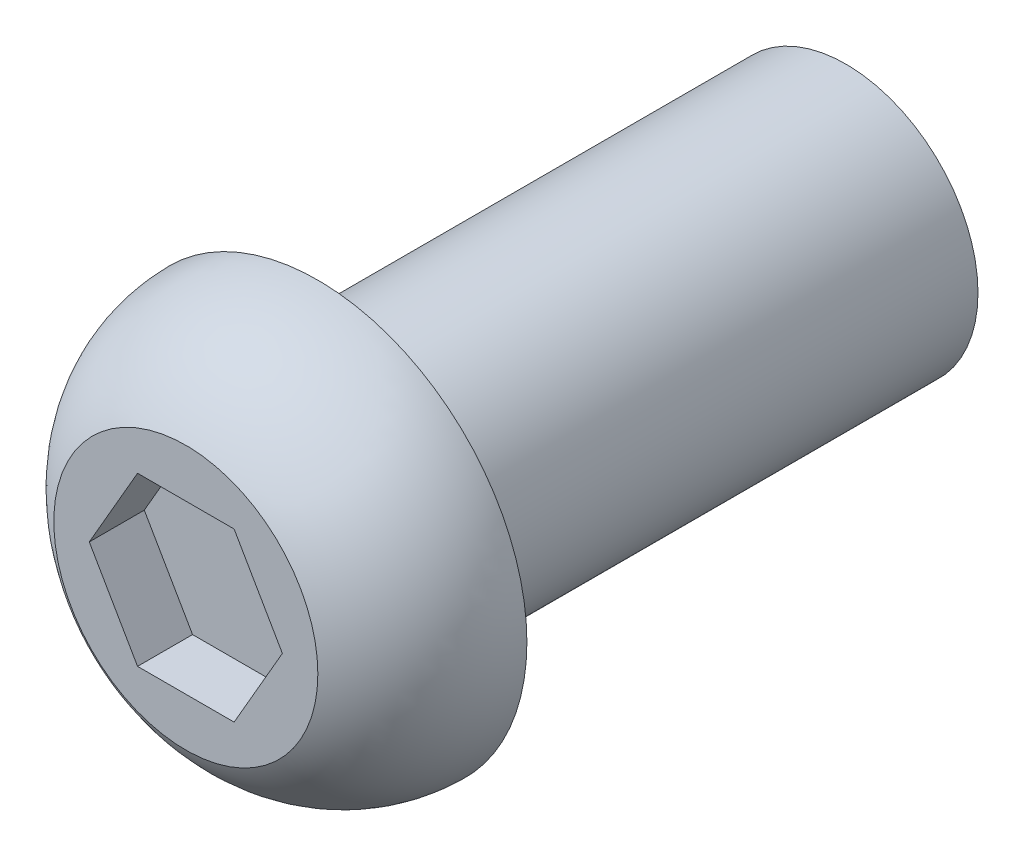
from build123d import *

# Parameters (mm, degrees)
CUT_EXTRUDE_1_DEPTH = 2.5


with BuildPart() as part:
    # 草图2 → 旋转1 (revolve)
    with BuildSketch(Plane(origin=(0, 0, 0), x_dir=(0, 0, -1), z_dir=(1, 0, 0)), mode=Mode.PRIVATE) as revolve_1_sk:
        Polygon((6, 9.5), (0, 9.5), (0, 0), (30, 0), (30, 6), (6, 6), align=None)
    revolve(revolve_1_sk.sketch.rotate(Axis((0, 0, 0), (0, 0, -1)), 90), axis=Axis((0, 0, 0), (0, 0, -1)))

    # 草图3 → 切除-拉伸1 (cut)
    with BuildSketch(Plane.XY):
        Polygon((2.193931023, -3.8), (4.387862046, 0), (2.193931023, 3.8), (-2.193931023, 3.8), (-4.387862046, 0), (-2.193931023, -3.8), align=None)
    extrude(amount=-CUT_EXTRUDE_1_DEPTH, mode=Mode.SUBTRACT)

    # 草图4 → 切除-旋转1 (revolve, cut)
    with BuildSketch(Plane(origin=(0, 0, 0), x_dir=(0, 0, -1), z_dir=(1, 0, 0)), mode=Mode.PRIVATE) as cut_revolve_1_sk:
        with BuildLine():
            Line((6, 9.5), (0, 9.5))
            Line((0, 9.5), (0, 6))
            ThreePointArc((0, 6), (2.526889003, 8.561047424), (6, 9.5))
        make_face()
    revolve(cut_revolve_1_sk.sketch.rotate(Axis((0, 0, 0), (0, 0, -1)), 90), axis=Axis((0, 0, 0), (0, 0, -1)), mode=Mode.SUBTRACT)


solid = part.part
